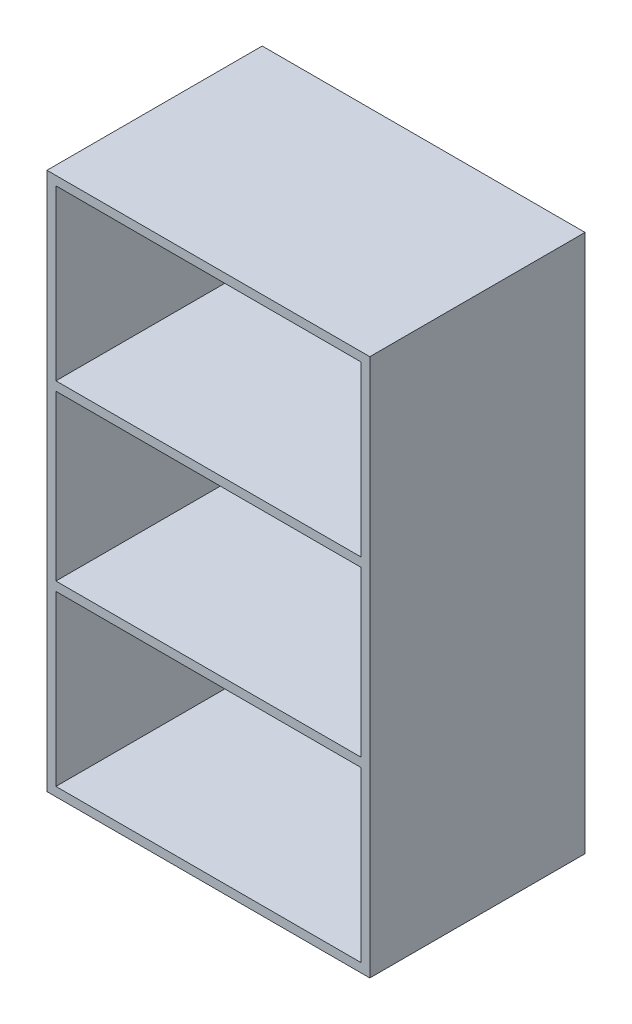
from build123d import *

# Parameters (mm, degrees)
SKETCH1_W           = 914.4
SKETCH1_H           = 609.6
BOSS_EXTRUDE1_DEPTH = 1524
SKETCH2_W           = 863.6
SKETCH2_H           = 478.366666667
SKETCH2_H_2         = 465.666666666
CUT_EXTRUDE1_DEPTH  = 1704.883798855


with BuildPart() as part:
    # Sketch1 → Boss-Extrude1 (new body)
    with BuildSketch(Plane(origin=(0, 0, 0), x_dir=(1, 0, 0), z_dir=(0, 1, 0))):
        Rectangle(SKETCH1_W, SKETCH1_H)
    extrude(amount=BOSS_EXTRUDE1_DEPTH)

    # Sketch2 → Cut-Extrude1 (cut, through all)
    with BuildSketch(Plane.XY.offset(304.8)):
        with Locations((0, 264.583333334)):
            Rectangle(SKETCH2_W, SKETCH2_H)
        with Locations((0, 1259.416666667)):
            Rectangle(SKETCH2_W, SKETCH2_H)
        with Locations((0, 762)):
            Rectangle(SKETCH2_W, SKETCH2_H_2)
    extrude(amount=-CUT_EXTRUDE1_DEPTH, mode=Mode.SUBTRACT)


solid = part.part
